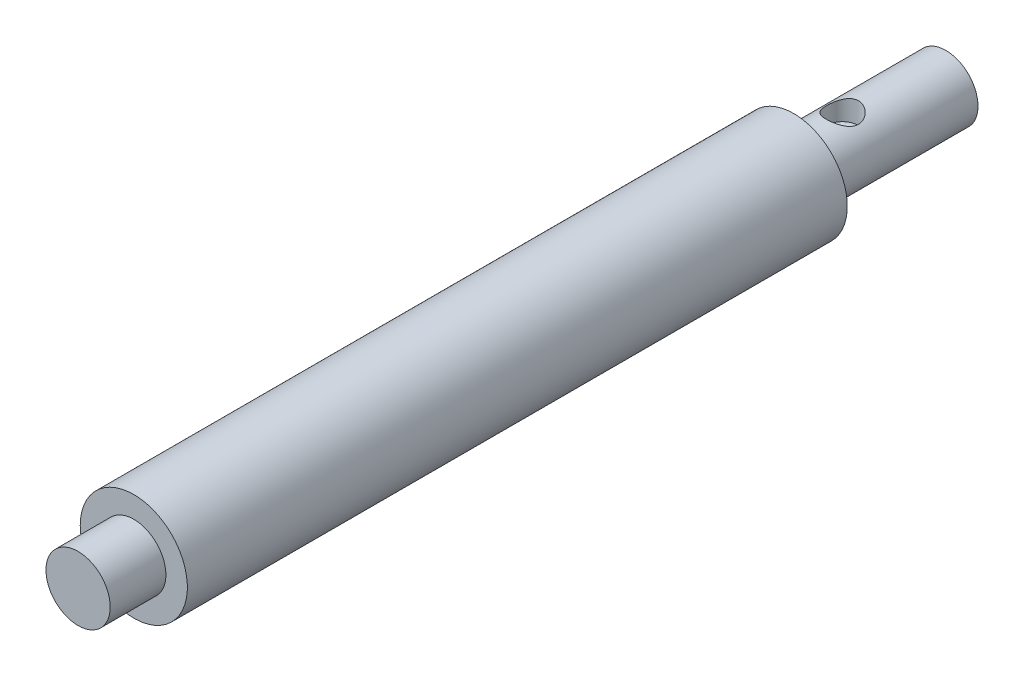
from build123d import *

# Parameters (mm, degrees)
SKETCH1_R      = 5
EXTRUDE1_DEPTH = 61.6
SKETCH2_R      = 3
EXTRUDE2_DEPTH = 5.2
EXTRUDE3_START = 14.2
SKETCH3_R      = 3
EXTRUDE3_DEPTH = 14.2
SKETCH5_R      = 1.5
EXTRUDE5_DEPTH = 2


with BuildPart() as part:
    # Sketch1 → Extrude1 (new body)
    with BuildSketch(Plane.XY):
        with Locations(Location((0, 0, 0), (0, 0, 180))):
            Circle(SKETCH1_R)
    extrude(amount=EXTRUDE1_DEPTH)

    # Sketch2 → Extrude2 (add)
    with BuildSketch(Plane.XY.offset(61.6)):
        Circle(SKETCH2_R)
    extrude(amount=EXTRUDE2_DEPTH)

    # Sketch3 → Extrude3 (add)
    with BuildSketch(Plane(origin=(0, 0, 0), x_dir=(-1, 0, 0), z_dir=(0, 0, -1)).offset(EXTRUDE3_START)):
        with Locations(Location((0, 0, 0), (0, 0, 180))):
            Circle(SKETCH3_R)
    extrude(amount=-EXTRUDE3_DEPTH)

    # Sketch5 → Extrude5 (cut)
    with BuildSketch(Plane(origin=(0, 3, 0), x_dir=(-1, 0, 0), z_dir=(0, 1, 0))):
        with Locations(Location((0, -4.55, 0), (0, 0, 90))):
            Circle(SKETCH5_R)
    extrude(amount=-EXTRUDE5_DEPTH, mode=Mode.SUBTRACT)


solid = part.part
